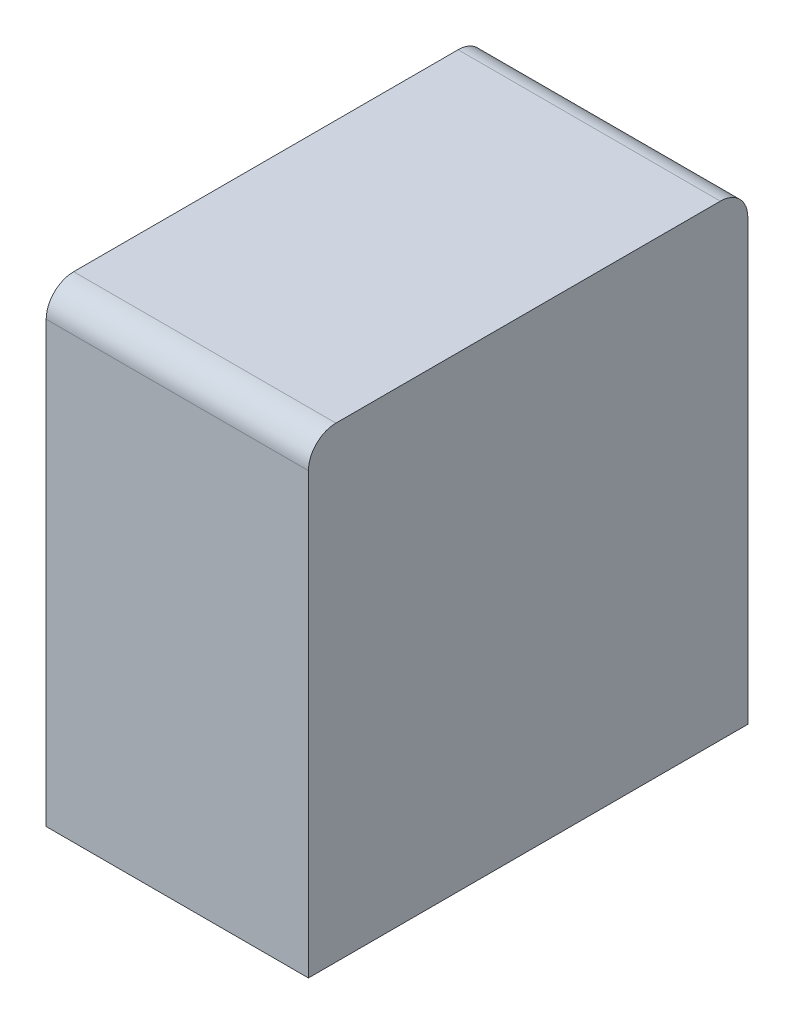
from build123d import *

# Parameters (mm, degrees)
SKETCH_1_W      = 9.55
SKETCH_1_H      = 16
EXTRUDE_1_DEPTH = 17
SKETCH_2_R      = 0.6
EXTRUDE_2_DEPTH = 4
FILLET_1_R      = 1


with BuildPart() as part:
    # 草图1 → 拉伸1 (new body)
    with BuildSketch(Plane(origin=(0, 0, 0), x_dir=(1, 0, 0), z_dir=(0, 1, 0))):
        Rectangle(SKETCH_1_W, SKETCH_1_H)
    extrude(amount=EXTRUDE_1_DEPTH)

    # 草图2 → 拉伸2 (add)
    with BuildSketch(Plane.XZ):
        with Locations(Location((-2, 0, 0), (0, 0, 90))):
            Circle(SKETCH_2_R)
    extrude(amount=EXTRUDE_2_DEPTH)

    # 圆角1
    fillet_1_edges = [part.edges().sort_by_distance(p)[0] for p in [
        (0, 17, -8),
        (0, 17, 8),
    ]]
    fillet(fillet_1_edges, radius=FILLET_1_R)


solid = part.part
